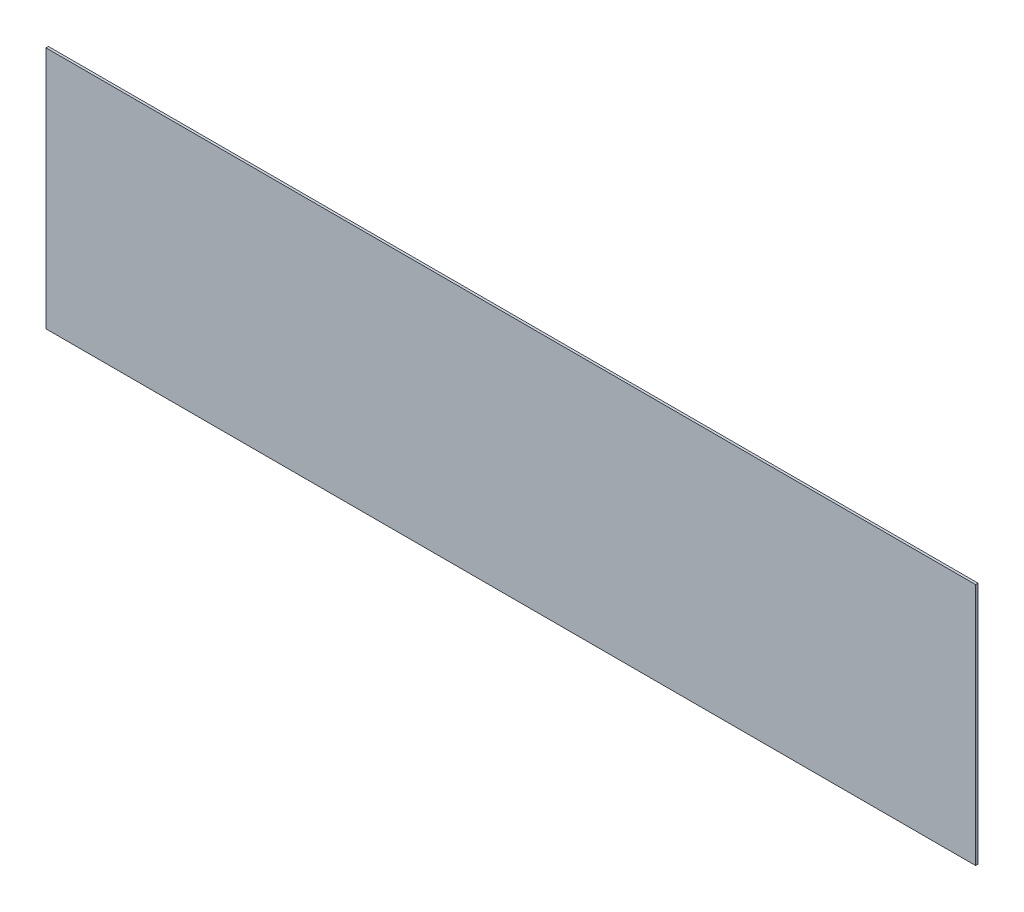
from build123d import *

# Parameters (mm, degrees)
SKETCH1_W           = 378.12
SKETCH1_H           = 99
BOSS_EXTRUDE1_DEPTH = 1


with BuildPart() as part:
    # Sketch1 → Boss-Extrude1 (new body)
    with BuildSketch(Plane.XY):
        Rectangle(SKETCH1_W, SKETCH1_H)
    extrude(amount=BOSS_EXTRUDE1_DEPTH)


solid = part.part
